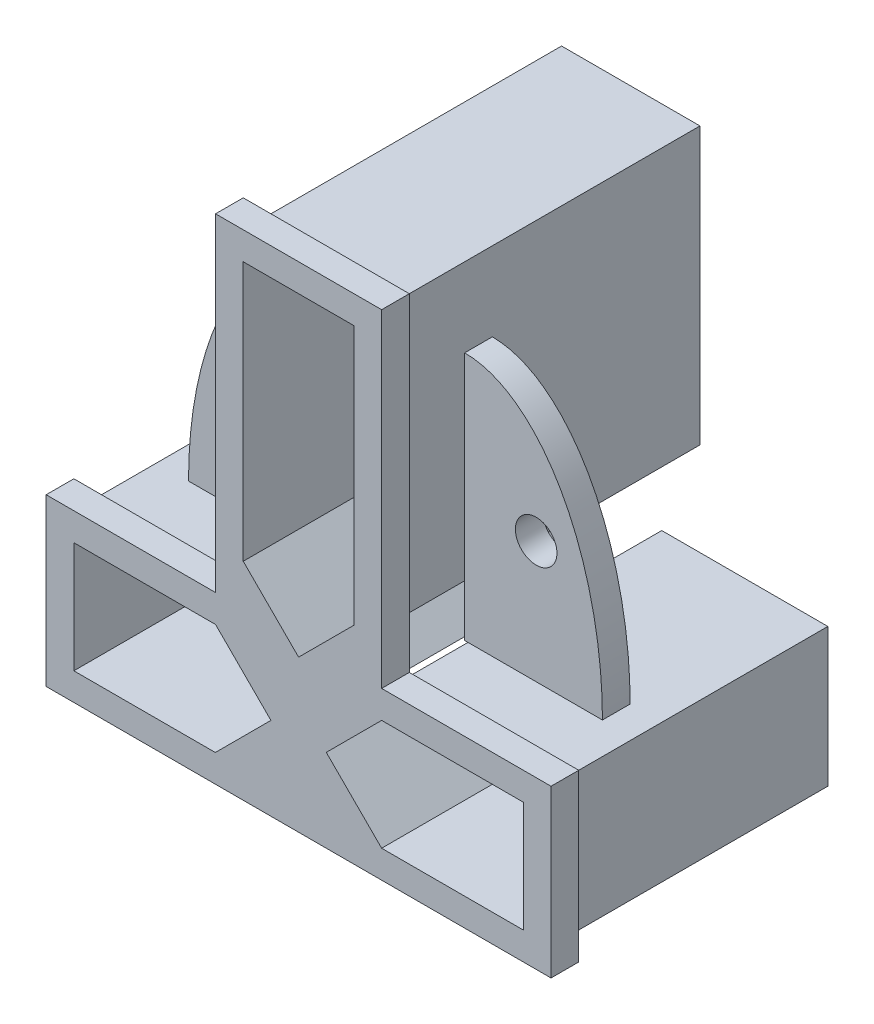
from build123d import *

# Parameters (mm, degrees)
BOSS_EXTRUDE1_DEPTH = 2
BOSS_EXTRUDE2_DEPTH = 20
BOSS_EXTRUDE3_DEPTH = 23
CHAMFER1_SIZE       = 1
CUT_EXTRUDE1_DEPTH  = 28
CUT_EXTRUDE2_DEPTH  = 19
CHAMFER2_SIZE       = 1
BOSS_EXTRUDE4_START = 5
BOSS_EXTRUDE4_DEPTH = 2
SKETCH8_R           = 1.5
CUT_EXTRUDE3_DEPTH  = 2
SKETCH9_R           = 1.625
CUT_EXTRUDE4_DEPTH  = 5
SKETCH10_R          = 1.25
BOSS_EXTRUDE5_DEPTH = 2


with BuildPart() as part:
    # Sketch2 → Boss-Extrude1 (new body)
    with BuildSketch(Plane.XY):
        Polygon((29.88488863, -2.595574528), (29.88488863, -26.295574528), (17.64488863, -26.295574528), (17.64488863, -38.295574528), (54.12488863, -38.295574528), (54.12488863, -26.295574528), (41.88488863, -26.295574528), (41.88488863, -2.595574528), align=None)
    extrude(amount=BOSS_EXTRUDE1_DEPTH)

    # Sketch3 → Boss-Extrude2 (add)
    with BuildSketch(Plane(origin=(0, 0, 0), x_dir=(-1, 0, 0), z_dir=(0, 0, -1))):
        Polygon((-53.12488863, -37.295574528), (-53.12488863, -27.295574528), (-41.12488863, -27.295574528), (-36.12488863, -32.295574528), (-41.12488863, -37.295574528), align=None)
        Polygon((-35.64488863, -32.295574528), (-30.64488863, -27.295574528), (-18.64488863, -27.295574528), (-18.64488863, -37.295574528), (-30.64488863, -37.295574528), align=None)
    extrude(amount=BOSS_EXTRUDE2_DEPTH)

    # Sketch3<3> → Boss-Extrude3 (add)
    with BuildSketch(Plane(origin=(0, 0, 0), x_dir=(-1, 0, 0), z_dir=(0, 0, -1))):
        Polygon((-40.88488863, -3.595574528), (-30.88488863, -3.595574528), (-30.88488863, -23.557914395), (-35.88488863, -28.557914395), (-40.88488863, -23.557914395), align=None)
    extrude(amount=BOSS_EXTRUDE3_DEPTH)

    # Chamfer1
    chamfer1_edges = [part.edges().sort_by_distance(p)[0] for p in [
        (53.12488863, -32.295574528, -20),
        (47.12488863, -37.295574528, -20),
        (38.62488863, -34.795574528, -20),
        (38.62488863, -29.795574528, -20),
        (47.12488863, -27.295574528, -20),
        (33.14488863, -29.795574528, -20),
        (33.14488863, -34.795574528, -20),
        (24.64488863, -37.295574528, -20),
        (18.64488863, -32.295574528, -20),
        (24.64488863, -27.295574528, -20),
        (40.88488863, -13.576744462, -23),
        (38.38488863, -26.057914395, -23),
        (33.38488863, -26.057914395, -23),
        (30.88488863, -13.576744462, -23),
        (35.88488863, -3.595574528, -23),
    ]]
    chamfer(chamfer1_edges, length=CHAMFER1_SIZE)

    # Sketch4 → Cut-Extrude1 (cut)
    with BuildSketch(Plane.XY.offset(2)):
        Polygon((31.88488863, -23.338741615), (31.88488863, -4.595574528), (39.88488863, -4.595574528), (39.88488863, -23.338741615), (35.88488863, -27.338741615), align=None)
    extrude(amount=-CUT_EXTRUDE1_DEPTH, mode=Mode.SUBTRACT)

    # Sketch4<3> → Cut-Extrude2 (cut)
    with BuildSketch(Plane.XY.offset(2)):
        Polygon((19.64488863, -36.312819682), (19.64488863, -28.295574528), (29.88488863, -28.295574528), (33.88488863, -32.295574528), (29.867643476, -36.312819682), align=None)
        Polygon((37.88488863, -32.295574528), (41.88488863, -28.295574528), (52.12488863, -28.295574528), (52.12488863, -36.295574528), (41.88488863, -36.295574528), align=None)
    extrude(amount=-CUT_EXTRUDE2_DEPTH, mode=Mode.SUBTRACT)

    # Chamfer2
    chamfer2_edges = [part.edges().sort_by_distance(p)[0] for p in [
        (19.64488863, -32.304197105, -17),
        (24.76488863, -28.295574528, -17),
        (31.88488863, -30.295574528, -17),
        (31.876266053, -34.304197105, -17),
        (24.756266053, -36.312819682, -17),
        (39.88488863, -30.295574528, -17),
        (47.00488863, -28.295574528, -17),
        (52.12488863, -32.295574528, -17),
        (47.00488863, -36.295574528, -17),
        (39.88488863, -34.295574528, -17),
    ]]
    chamfer(chamfer2_edges, length=CHAMFER2_SIZE)

    # Sketch7 → Boss-Extrude4 (add)
    with BuildSketch(Plane(origin=(0, 0, 0), x_dir=(-1, 0, 0), z_dir=(0, 0, -1)).offset(BOSS_EXTRUDE4_START)):
        with BuildLine():
            Line((-30.88488863, -9.295574528), (-30.88488863, -27.295574528))
            Line((-30.88488863, -27.295574528), (-20.930717386, -27.295574528))
            add(Edge.make_bspline(
                [(-20.930717386, -27.295574528), (-20.930717386, -9.295574528), (-30.88488863, -9.295574528)],
                knots=[4.71238898, 4.71238898, 4.71238898, 6.283185307, 6.283185307, 6.283185307], degree=2, weights=[1, 0.707106781, 1]))
        make_face()
        with BuildLine():
            Line((-40.88488863, -27.295574528), (-50.839059874, -27.295574528))
            add(Edge.make_bspline(
                [(-40.88488863, -9.295574528), (-50.839059874, -9.295574528), (-50.839059874, -27.295574528)],
                knots=[0, 0, 0, 1.570796327, 1.570796327, 1.570796327], degree=2, weights=[1, 0.707106781, 1]))
            Line((-40.88488863, -9.295574528), (-40.88488863, -27.295574528))
        make_face()
    extrude(amount=BOSS_EXTRUDE4_DEPTH)

    # Sketch8 → Cut-Extrude3 (cut)
    with BuildSketch(Plane(origin=(0, 0, -7), x_dir=(-1, 0, 0), z_dir=(0, 0, -1))):
        with Locations((-25.71892105, -18.498352077)):
            Circle(SKETCH8_R)
        with Locations(Location((-46.05085621, -18.498352077, 0), (0, 0, 180))):
            Circle(SKETCH8_R)
    extrude(amount=-CUT_EXTRUDE3_DEPTH, mode=Mode.SUBTRACT)

    # Sketch9 → Cut-Extrude4 (cut)
    with BuildSketch(Plane.XZ.offset(37.295574528)):
        with Locations(Location((23.88488863, -13.628778028, 0), (0, 0, 270))):
            Circle(SKETCH9_R)
        with Locations(Location((47.88488863, -13.628778028, 0), (0, 0, 270))):
            Circle(SKETCH9_R)
    extrude(amount=-CUT_EXTRUDE4_DEPTH, mode=Mode.SUBTRACT)

    # Sketch10 → Boss-Extrude5 (add)
    with BuildSketch(Plane.XY.offset(-17)):
        with Locations((46.906421739, -32.180011543)):
            Circle(SKETCH10_R)
        with Locations((24.906421739, -32.180011543)):
            Circle(SKETCH10_R)
    extrude(amount=BOSS_EXTRUDE5_DEPTH)


solid = part.part
